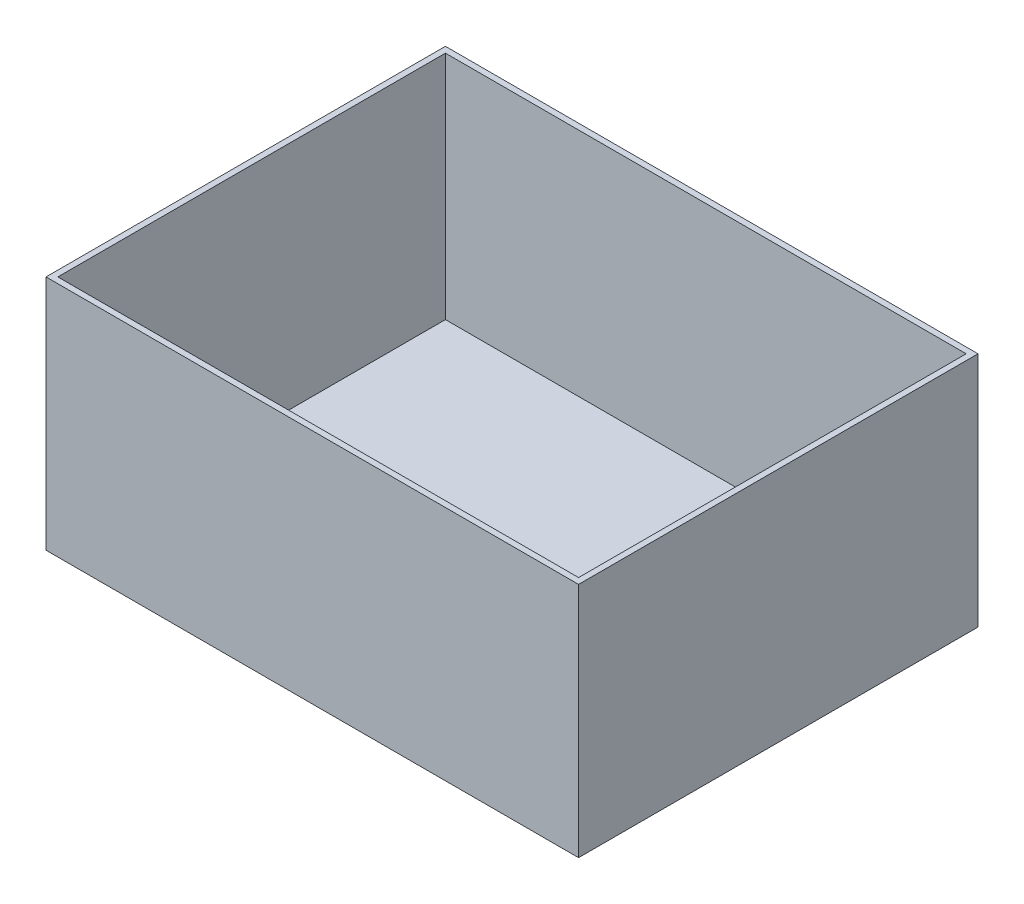
from build123d import *

# Parameters (mm, degrees)
SKETCH1_W           = 900
SKETCH1_H           = 400
BOSS_EXTRUDE1_DEPTH = 675
SHELL1_T            = -10
SKETCH3_W           = 50
SKETCH3_H           = 10
BOSS_EXTRUDE4_DEPTH = 50


with BuildPart() as part:
    # Sketch1 → Boss-Extrude1 (new body)
    with BuildSketch(Plane.XY):
        with Locations((-450, 200)):
            Rectangle(SKETCH1_W, SKETCH1_H)
    extrude(amount=BOSS_EXTRUDE1_DEPTH)

    # Shell1
    shell1_openings = [part.faces().sort_by_distance(p)[0] for p in [
        (-450, 400, 337.5),
    ]]
    offset(amount=SHELL1_T, openings=shell1_openings, kind=Kind.INTERSECTION)

    # Sketch3 → Boss-Extrude4 (add)
    with BuildSketch(Plane(origin=(0, 0, 0), x_dir=(-1, 0, 0), z_dir=(0, -1, 0))):
        with Locations((275, -230)):
            Rectangle(SKETCH3_W, SKETCH3_H)
        with Locations((275, -445)):
            Rectangle(SKETCH3_W, SKETCH3_H)
    extrude(amount=BOSS_EXTRUDE4_DEPTH)


solid = part.part
